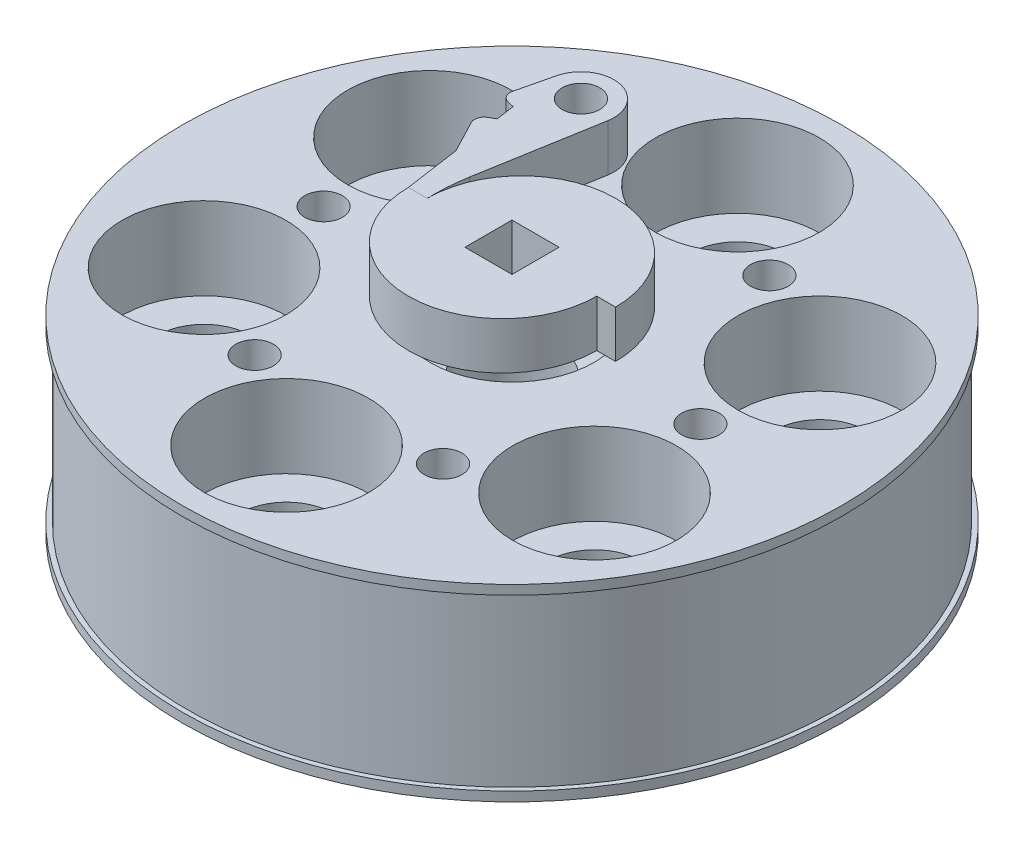
from build123d import *

# Parameters (mm, degrees)
SKETCH1_R           = 44.45
BOSS_EXTRUDE1_DEPTH = 12.7
SKETCH2_R           = 11.05
CUT_EXTRUDE1_DEPTH  = 25.4
SKETCH3_R           = 11.05
SKETCH3_R_2         = 6.35
BOSS_EXTRUDE2_DEPTH = 1.5875
SKETCH4_R           = 11.05
SKETCH4_R_2         = 6.35
CUT_EXTRUDE2_DEPTH  = 7
SKETCH4_2_R         = 6.35
CUT_EXTRUDE3_DEPTH  = 30.622
SKETCH7_W           = 6.35
SKETCH7_H           = 6.35
BOSS_EXTRUDE3_DEPTH = 6.35
SKETCH8_R           = 2.54
BOSS_EXTRUDE4_DEPTH = 6.35
FILLET1_R           = 25.4
SKETCH9_R           = 2.54
CUT_EXTRUDE5_DEPTH  = 72.154718088
SKETCH10_W          = 0.635
SKETCH10_H          = 22.86


with BuildPart() as part:
    # Sketch1 → Boss-Extrude1 (new, symmetric)
    with BuildSketch(Plane(origin=(0, 0, 0), x_dir=(1, 0, 0), z_dir=(0, 1, 0))):
        Circle(SKETCH1_R)
    extrude(amount=BOSS_EXTRUDE1_DEPTH, both=True)

    # Sketch2 → Cut-Extrude1 (cut)
    with BuildSketch(Plane(origin=(0, 12.7, 0), x_dir=(1, 0, 0), z_dir=(0, 1, 0))):
        with Locations((0, 30.396662632)):
            Circle(SKETCH2_R)
        with Locations((26.32428203, 15.198331316)):
            Circle(SKETCH2_R)
        with Locations((26.32428203, -15.198331316)):
            Circle(SKETCH2_R)
        with Locations((0, -30.396662632)):
            Circle(SKETCH2_R)
        with Locations((-26.32428203, -15.198331316)):
            Circle(SKETCH2_R)
        with Locations((-26.32428203, 15.198331316)):
            Circle(SKETCH2_R)
    extrude(amount=-CUT_EXTRUDE1_DEPTH, mode=Mode.SUBTRACT)

    # Sketch3 → Boss-Extrude2 (add, symmetric)
    # profile 1 of 6: a face of its own
    with BuildSketch(Plane(origin=(0, 0, 0), x_dir=(1, 0, 0), z_dir=(0, 1, 0))):
        with Locations((-26.32428203, -15.198331316)):
            Circle(SKETCH3_R)
        with Locations((-26.32428203, -15.198331316)):
            Circle(SKETCH3_R_2, mode=Mode.SUBTRACT)
    # profile 2 of 6: a face of its own
    with BuildSketch(Plane(origin=(0, 0, 0), x_dir=(1, 0, 0), z_dir=(0, 1, 0))):
        with Locations((0, -30.396662632)):
            Circle(SKETCH3_R)
        with Locations((0, -30.396662632)):
            Circle(SKETCH3_R_2, mode=Mode.SUBTRACT)
    # profile 3 of 6: a face of its own
    with BuildSketch(Plane(origin=(0, 0, 0), x_dir=(1, 0, 0), z_dir=(0, 1, 0))):
        with Locations((26.32428203, -15.198331316)):
            Circle(SKETCH3_R)
        with Locations((26.32428203, -15.198331316)):
            Circle(SKETCH3_R_2, mode=Mode.SUBTRACT)
    # profile 4 of 6: a face of its own
    with BuildSketch(Plane(origin=(0, 0, 0), x_dir=(1, 0, 0), z_dir=(0, 1, 0))):
        with Locations((26.32428203, 15.198331316)):
            Circle(SKETCH3_R)
        with Locations((26.32428203, 15.198331316)):
            Circle(SKETCH3_R_2, mode=Mode.SUBTRACT)
    # profile 5 of 6: a face of its own
    with BuildSketch(Plane(origin=(0, 0, 0), x_dir=(1, 0, 0), z_dir=(0, 1, 0))):
        with Locations((0, 30.396662632)):
            Circle(SKETCH3_R)
        with Locations((0, 30.396662632)):
            Circle(SKETCH3_R_2, mode=Mode.SUBTRACT)
    # profile 6 of 6: a face of its own
    with BuildSketch(Plane(origin=(0, 0, 0), x_dir=(1, 0, 0), z_dir=(0, 1, 0))):
        with Locations((-26.32428203, 15.198331316)):
            Circle(SKETCH3_R)
        with Locations((-26.32428203, 15.198331316)):
            Circle(SKETCH3_R_2, mode=Mode.SUBTRACT)
    extrude(amount=BOSS_EXTRUDE2_DEPTH, both=True)

    # Sketch4 → Cut-Extrude2 (cut)
    with BuildSketch(Plane(origin=(0, 12.7, 0), x_dir=(1, 0, 0), z_dir=(0, 1, 0))):
        Circle(SKETCH4_R)
        Circle(SKETCH4_R_2, mode=Mode.SUBTRACT)
    cut_extrude2 = extrude(amount=-CUT_EXTRUDE2_DEPTH, mode=Mode.SUBTRACT)

    # Sketch4<2> → Cut-Extrude3 (cut)
    with BuildSketch(Plane(origin=(0, 12.7, 0), x_dir=(1, 0, 0), z_dir=(0, 1, 0))):
        Circle(SKETCH4_2_R)
    extrude(amount=-CUT_EXTRUDE3_DEPTH, mode=Mode.SUBTRACT)

    # Mirror1: Cut-Extrude2 across plane
    add(cut_extrude2.mirror(Plane.ZX), mode=Mode.SUBTRACT)

    # Sketch9 → Cut-Extrude5 (cut, through all)
    with BuildSketch(Plane(origin=(0, 12.7, 0), x_dir=(1, 0, 0), z_dir=(0, 1, 0))):
        with Locations((-12.7, 21.997045256)):
            Circle(SKETCH9_R)
        with Locations((12.7, 21.997045256)):
            Circle(SKETCH9_R)
        with Locations((25.4, 0)):
            Circle(SKETCH9_R)
        with Locations((12.7, -21.997045256)):
            Circle(SKETCH9_R)
        with Locations((-12.7, -21.997045256)):
            Circle(SKETCH9_R)
        with Locations((-25.4, 0)):
            Circle(SKETCH9_R)
    extrude(amount=-CUT_EXTRUDE5_DEPTH, mode=Mode.SUBTRACT)

    # Sketch10 → Cut-Revolve1 (revolve, cut)
    with BuildSketch(Plane(origin=(0, 0, 0), x_dir=(0, 0, -1), z_dir=(1, 0, 0))):
        with Locations((44.1325, 0)):
            Rectangle(SKETCH10_W, SKETCH10_H)
    revolve(axis=Axis((0, 0, 0), (0, 1, 0)), mode=Mode.SUBTRACT)


with BuildPart() as body_2:
    # Sketch7 → Boss-Extrude3 (new body)
    with BuildSketch(Plane(origin=(0, 14.2875, 0), x_dir=(1, 0, 0), z_dir=(0, 1, 0))):
        with BuildLine():
            Line((-13.97, 0), (-11.43, 0))
            ThreePointArc((-11.43, 0), (1.27, 12.7), (13.97, 0))
            Line((13.97, 0), (11.43, 0))
            ThreePointArc((11.43, 0), (-1.27, -12.7), (-13.97, 0))
        make_face()
        Rectangle(SKETCH7_W, SKETCH7_H, mode=Mode.SUBTRACT)
    extrude(amount=BOSS_EXTRUDE3_DEPTH)


with BuildPart() as body_3:
    # Mirror3: mirrored copy
    add(body_2.part.mirror(Plane.ZX))


with BuildPart() as body_4:
    # Sketch8 → Boss-Extrude4 (new body)
    with BuildSketch(Plane(origin=(0, 20.6375, 0), x_dir=(1, 0, 0), z_dir=(0, 1, 0))):
        with BuildLine():
            Line((-13.97, 0), (-11.43, 0))
            Line((-11.43, 0), (-11.43, 3.175))
            Line((-11.43, 3.175), (-8.319443305, 21.242891401))
            ThreePointArc((-8.319443305, 21.242891401), (-11.806326606, 26.351281454), (-17.023473214, 23.029326403))
            Line((-17.023473214, 23.029326403), (-18.167348398, 18.238467115))
            ThreePointArc((-18.167348398, 18.238467115), (-18.014096116, 17.278608437), (-17.227007807, 16.708251584))
            Line((-17.227007807, 16.708251584), (-16.351454793, 16.499202788))
            Line((-16.351454793, 16.499202788), (-15.98859765, 13.985254759))
            Line((-15.98859765, 13.985254759), (-16.813175965, 13.511961282))
            ThreePointArc((-16.813175965, 13.511961282), (-17.399855672, 12.767148466), (-17.307191961, 11.823563469))
            Line((-17.307191961, 11.823563469), (-15.051992467, 7.496263708))
            Line((-15.051992467, 7.496263708), (-13.97, 0))
        make_face()
        with Locations((-12.7, 21.997045256)):
            Circle(SKETCH8_R, mode=Mode.SUBTRACT)
    extrude(amount=-BOSS_EXTRUDE4_DEPTH)

    # Fillet1
    fillet1_edges = [body_4.edges().sort_by_distance(p)[0] for p in [
        (-11.43, 17.4625, -3.175),
    ]]
    fillet(fillet1_edges, radius=FILLET1_R)


with BuildPart() as body_5:
    # Mirror4: mirrored copy
    add(body_4.part.mirror(Plane.ZX))


solid = Compound([part.part, body_2.part, body_3.part, body_4.part, body_5.part])
